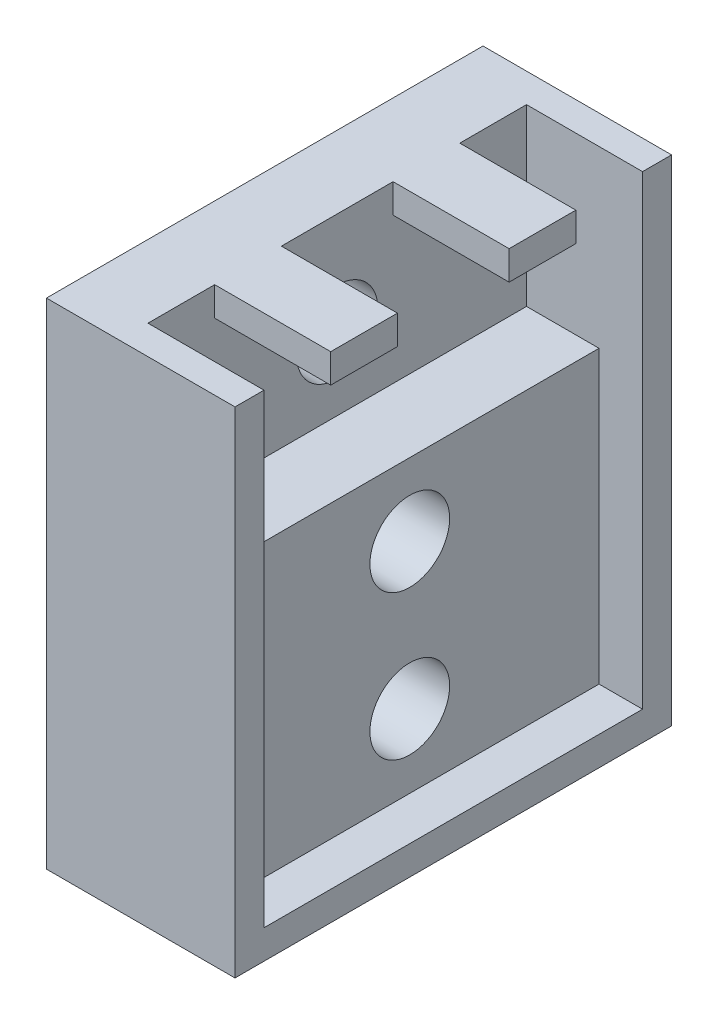
from build123d import *

# Parameters (mm, degrees)
SKETCH1_W           = 30.1
SKETCH1_H           = 34.1
SKETCH1_W_2         = 26.1
SKETCH1_H_2         = 30.1
BOSS_EXTRUDE1_DEPTH = 5
SKETCH2_W           = 10.8
SKETCH2_H           = 2
SKETCH2_W_2         = 4.6
BOSS_EXTRUDE2_DEPTH = 8
SKETCH3_R           = 1.7
CUT_EXTRUDE1_DEPTH  = 25.108193628
SKETCH4_R           = 2.8
CUT_EXTRUDE2_DEPTH  = 3
SKETCH6_W           = 26.1
SKETCH6_H           = 20.05
SKETCH6_R           = 2.75
BOSS_EXTRUDE3_DEPTH = 5


with BuildPart() as part:
    # Sketch1 → Boss-Extrude1 (new body)
    # profile 1 of 2: a face of its own
    with BuildSketch(Plane(origin=(0, 0, 0), x_dir=(0, 0, -1), z_dir=(1, 0, 0))):
        Rectangle(SKETCH1_W, SKETCH1_H)
        Rectangle(SKETCH1_W_2, SKETCH1_H_2, mode=Mode.SUBTRACT)
    # profile 2 of 2: a face of its own
    with BuildSketch(Plane(origin=(0, 0, 0), x_dir=(0, 0, -1), z_dir=(1, 0, 0))):
        Rectangle(SKETCH1_W_2, SKETCH1_H_2)
    extrude(amount=BOSS_EXTRUDE1_DEPTH)

    # Sketch2 → Boss-Extrude2 (add)
    with BuildSketch(Plane(origin=(5, 0, 0), x_dir=(0, 0, -1), z_dir=(1, 0, 0))):
        with Locations((7.65, -16.05)):
            Rectangle(SKETCH2_W, SKETCH2_H)
        Polygon((13.05, 15.05), (13.05, -15.05), (13.05, -17.05), (15.05, -17.05), (15.05, 17.05), (13.05, 17.05), align=None)
        with Locations((6.15, 16.05)):
            Rectangle(SKETCH2_W_2, SKETCH2_H)
        with Locations((-6.15, 16.05)):
            Rectangle(SKETCH2_W_2, SKETCH2_H)
        Polygon((-13.05, -15.05), (-13.05, 15.05), (-13.05, 17.05), (-15.05, 17.05), (-15.05, -17.05), (2.25, -17.05), (2.25, -15.05), align=None)
    extrude(amount=BOSS_EXTRUDE2_DEPTH)

    # Sketch3 → Cut-Extrude1 (cut, through all)
    with BuildSketch(Plane(origin=(5, 0, 0), x_dir=(0, 0, -1), z_dir=(1, 0, 0))):
        with Locations((0, -10)):
            Circle(SKETCH3_R)
        Circle(SKETCH3_R)
        with Locations((0, 10)):
            Circle(SKETCH3_R)
    extrude(amount=-CUT_EXTRUDE1_DEPTH, mode=Mode.SUBTRACT)

    # Sketch4 → Cut-Extrude2 (cut)
    with BuildSketch(Plane(origin=(5, 0, 0), x_dir=(0, 0, -1), z_dir=(1, 0, 0))):
        with Locations((0, -10)):
            Circle(SKETCH4_R)
        Circle(SKETCH4_R)
        with Locations((0, 10)):
            Circle(SKETCH4_R)
    extrude(amount=-CUT_EXTRUDE2_DEPTH, mode=Mode.SUBTRACT)

    # Sketch6 → Boss-Extrude3 (add)
    with BuildSketch(Plane(origin=(5, 0, 0), x_dir=(0, 0, -1), z_dir=(1, 0, 0))):
        with Locations((0, -5.025)):
            Rectangle(SKETCH6_W, SKETCH6_H)
        Circle(SKETCH6_R, mode=Mode.SUBTRACT)
        with Locations((0, -10)):
            Circle(SKETCH6_R, mode=Mode.SUBTRACT)
    extrude(amount=BOSS_EXTRUDE3_DEPTH)


solid = part.part
